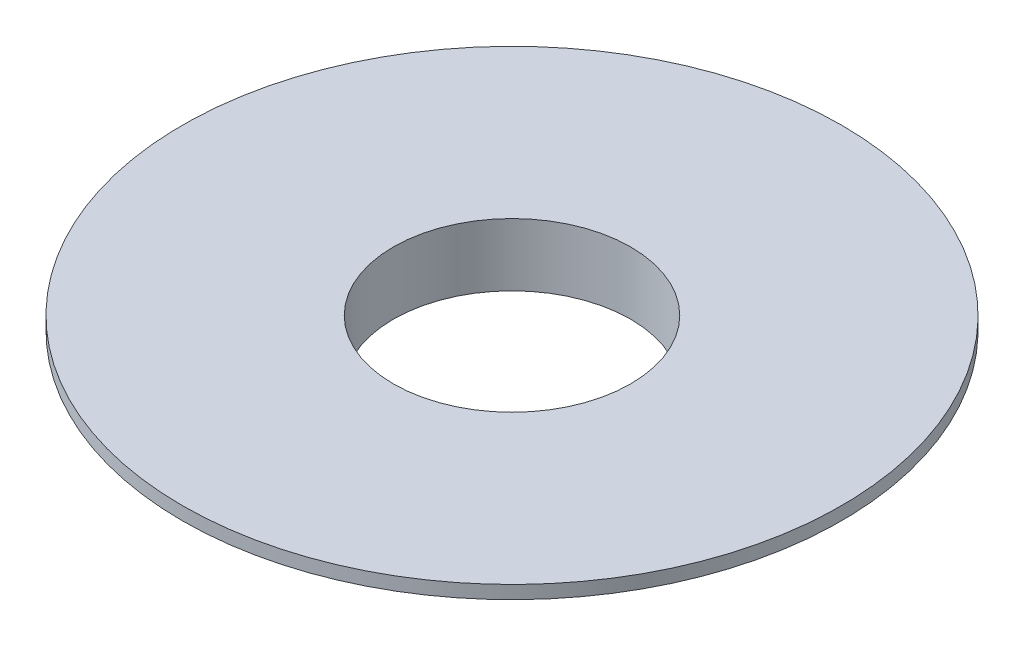
from build123d import *


with BuildPart() as part:
    # Esquisse1 → Révolution1 (revolve)
    with BuildSketch(Plane(origin=(0, 0, 0), x_dir=(-1, 0, 0), z_dir=(0, 0, -1)), mode=Mode.PRIVATE) as r_volution1_sk:
        Polygon((-22, -6.837481737), (-22, -14.337481737), (-18, -14.337481737), (-18, -4.837481737), (-50, -4.837481737), (-50, -6.837481737), align=None)
    revolve(r_volution1_sk.sketch.rotate(Axis((0, -14.337481737, 0), (0, 1, 0)), 270), axis=Axis((0, -14.337481737, 0), (0, 1, 0)))


solid = part.part
